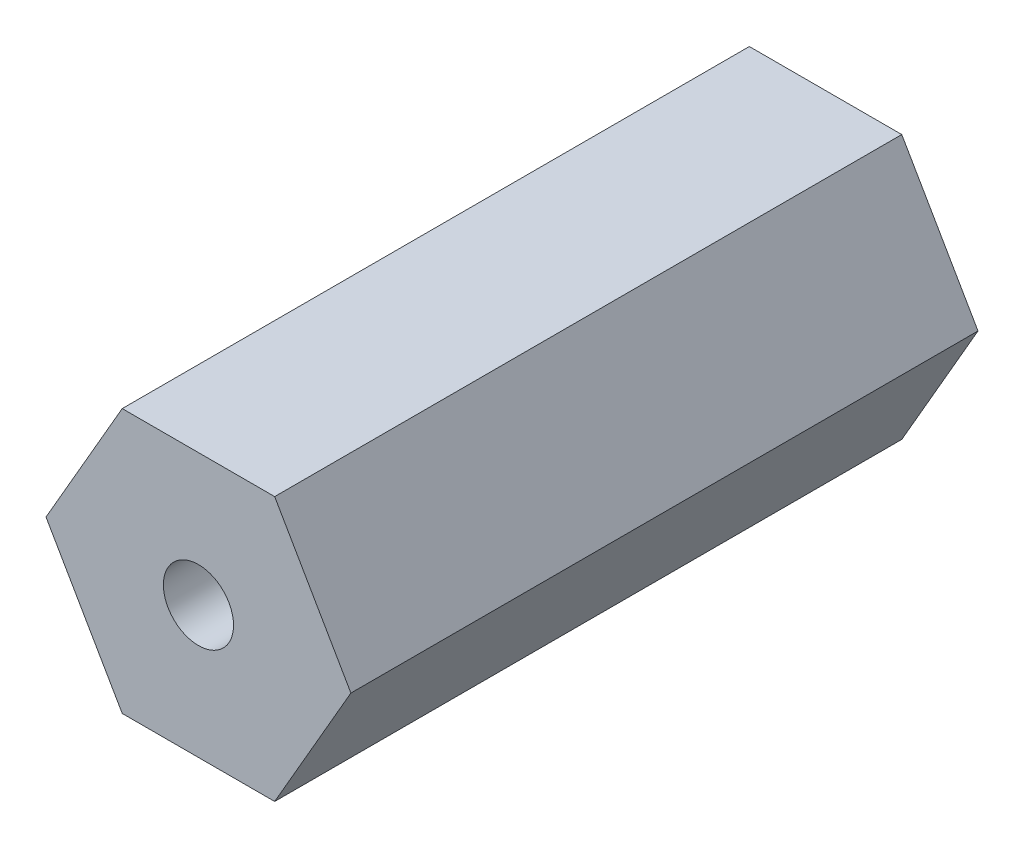
from build123d import *

# Parameters (mm, degrees)
SKETCH1_R             = 5.08
BOSS_EXTRUDE1_DEPTH   = 24.13
M3X0_5_TAPPED_HOLE1_D = 2.7


with BuildPart() as part:
    # Sketch1 → Boss-Extrude1 (new body)
    with BuildSketch(Plane.XY):
        Circle(SKETCH1_R)
        with BuildLine():
            Line((-2.932939367, 5.08), (-4.399409037, 2.540000024))
            ThreePointArc((-4.399409037, 2.540000024), (-2.539999988, 4.399409058), (0, 5.08))
            Line((0, 5.08), (-2.932939367, 5.08))
        make_face()
        with BuildLine():
            Line((2.932939367, 5.08), (0, 5.08))
            ThreePointArc((0, 5.08), (2.539999994, 4.399409055), (4.399409045, 2.540000012))
            Line((4.399409045, 2.540000012), (2.932939367, 5.08))
        make_face()
        with BuildLine():
            ThreePointArc((5.08, 0), (4.906903196, -1.314800756), (4.399409045, -2.540000012))
            Line((4.399409045, -2.540000012), (5.865878735, 0))
            Line((5.865878735, 0), (4.399409045, 2.540000012))
            ThreePointArc((4.399409045, 2.540000012), (4.906903196, 1.314800756), (5.08, 0))
        make_face()
        with BuildLine():
            ThreePointArc((4.399409045, -2.540000012), (2.539999994, -4.399409055), (0, -5.08))
            Line((0, -5.08), (2.932939367, -5.08))
            Line((2.932939367, -5.08), (4.399409045, -2.540000012))
        make_face()
        with BuildLine():
            Line((-4.399409037, 2.540000024), (-5.865878735, 0))
            Line((-5.865878735, 0), (-4.399409045, -2.540000012))
            ThreePointArc((-4.399409045, -2.540000012), (-5.08, 7e-09), (-4.399409037, 2.540000024))
        make_face()
        with BuildLine():
            ThreePointArc((0, -5.08), (-2.539999994, -4.399409055), (-4.399409045, -2.540000012))
            Line((-4.399409045, -2.540000012), (-2.932939367, -5.08))
            Line((-2.932939367, -5.08), (0, -5.08))
        make_face()
    extrude(amount=BOSS_EXTRUDE1_DEPTH)

    # M3x0.5 Tapped Hole1 (through all)
    with Locations(Plane.XY.offset(24.13)):
        with Locations((0, 0)):
            Hole(M3X0_5_TAPPED_HOLE1_D / 2)


solid = part.part
